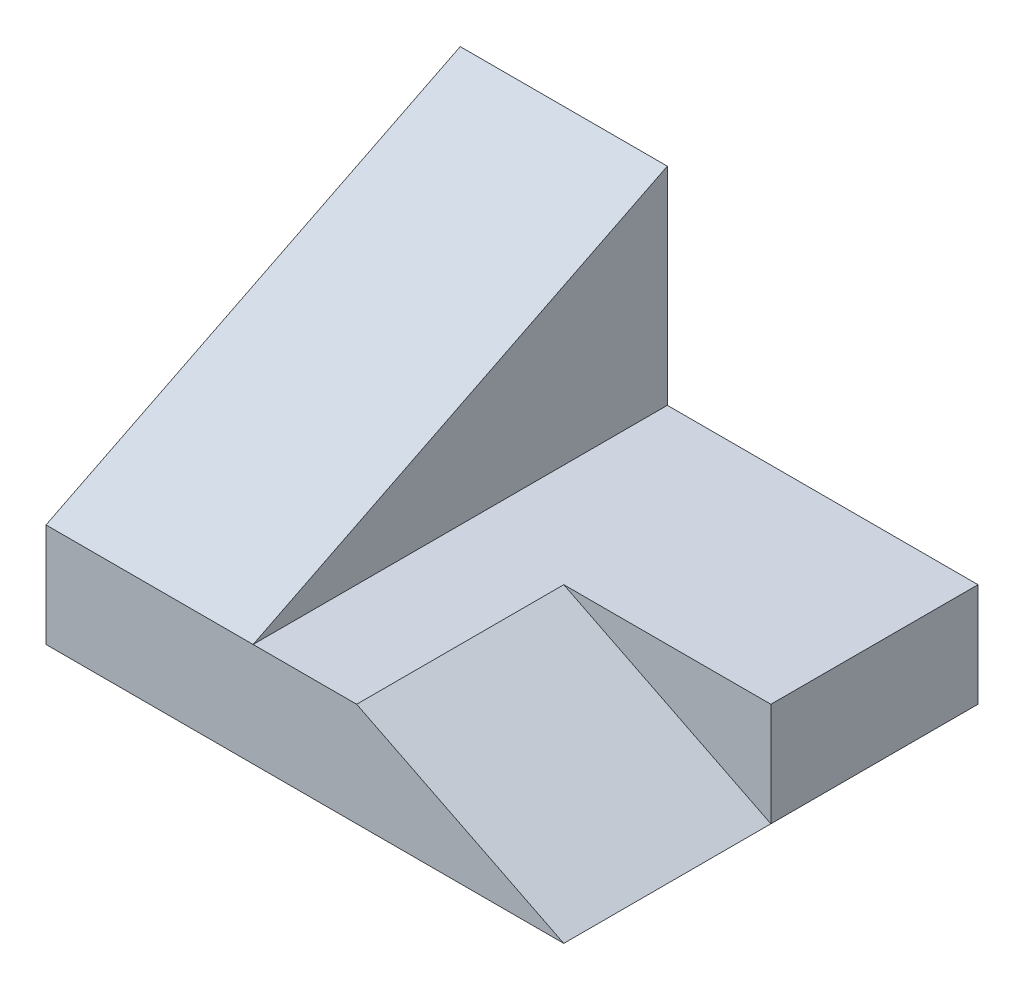
from build123d import *

# Parameters (mm, degrees)
SKETCH2_W           = 127
SKETCH2_H           = 101.6
BOSS_EXTRUDE1_DEPTH = 25.4
CUT_EXTRUDE2_DEPTH  = 50.8
BOSS_EXTRUDE2_DEPTH = 50.8


with BuildPart() as part:
    # Sketch2 → Boss-Extrude1 (new body)
    with BuildSketch(Plane(origin=(0, 0, 0), x_dir=(1, 0, 0), z_dir=(0, 1, 0))):
        with Locations((63.5, 50.8)):
            Rectangle(SKETCH2_W, SKETCH2_H)
    extrude(amount=BOSS_EXTRUDE1_DEPTH)

    # Sketch4 → Cut-Extrude2 (cut)
    with BuildSketch(Plane.XY):
        Polygon((76.2, 25.4), (127, 25.4), (127, 0), align=None)
    extrude(amount=-CUT_EXTRUDE2_DEPTH, mode=Mode.SUBTRACT)

    # Sketch5 → Boss-Extrude2 (add)
    with BuildSketch(Plane.ZY):
        Polygon((-101.6, 25.4), (0, 25.4), (-101.6, 76.2), align=None)
    extrude(amount=-BOSS_EXTRUDE2_DEPTH)


solid = part.part
